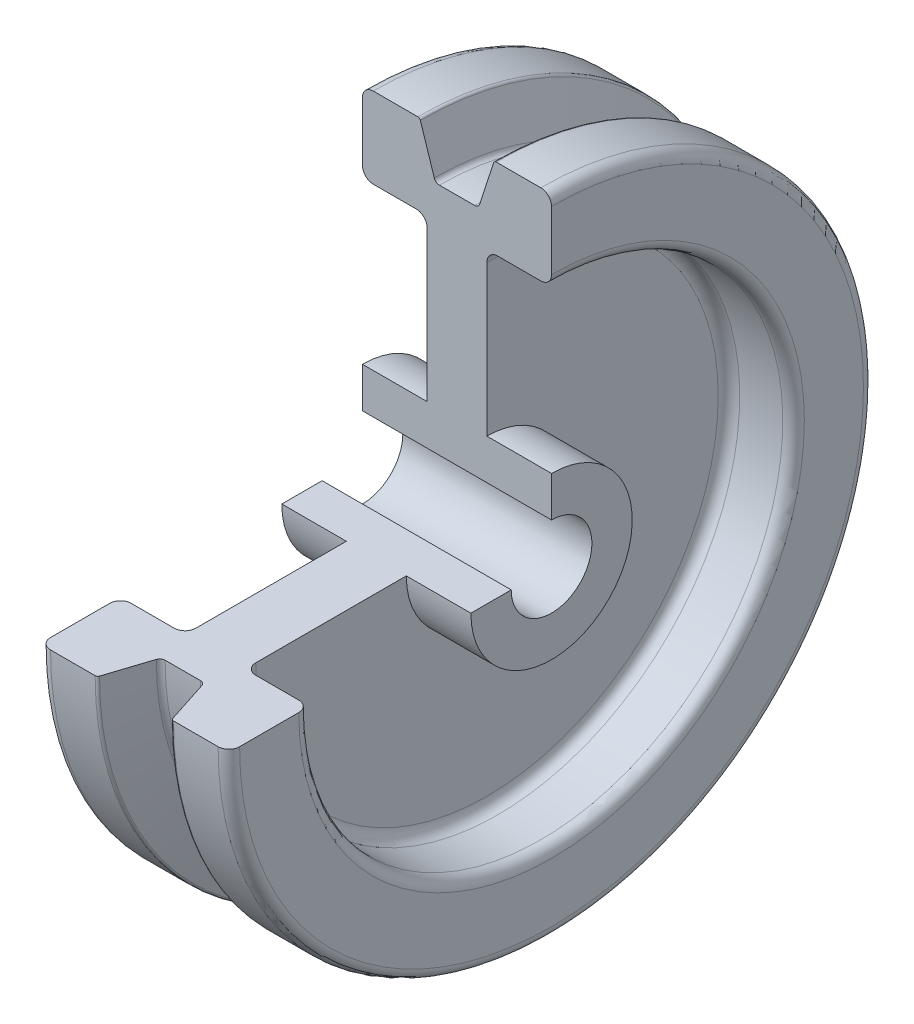
from build123d import *

# Parameters (mm, degrees)
FILLET_1_R          = 0.5
FILLET_2_R          = 1
FILLET_3_R          = 2
SKETCH_2_W          = 70
SKETCH_2_H          = 70
CUT_EXTRUDE_2_DEPTH = 40
FILLET_4_R          = 2


with BuildPart() as part:
    # 스케치1 → 회전1 (revolve)
    with BuildSketch(Plane.XY, mode=Mode.PRIVATE) as revolve_1_sk:
        Polygon((2.856091268, 7.5), (20.435341988, 7.5), (20.435341988, 15), (8.42765707, 15), (8.42765707, 45), (20.435341988, 45), (20.435341988, 60), (9.780368534, 60), (6.856091268, 51), (2.856091268, 51), align=None)
    revolve_1 = revolve(revolve_1_sk.sketch.rotate(Axis((-22.814601345, 0, 0), (1, 0, 0)), 90), axis=Axis((-22.814601345, 0, 0), (1, 0, 0)))

    # 대칭 복사2: 회전1 across plane
    add(revolve_1.mirror(Plane(origin=(2.856091268, 51, 0), x_dir=(0, 0, 1), z_dir=(1, 0, 0))))

    # 필렛1
    fillet_1_edges = [part.edges().sort_by_distance(p)[0] for p in [
        (-4.068185998, 0, -60),
        (9.780368534, 0, -60),
    ]]
    fillet(fillet_1_edges, radius=FILLET_1_R)

    # 필렛2
    fillet_2_edges = [part.edges().sort_by_distance(p)[0] for p in [
        (-1.143908732, 0, -51),
        (6.856091268, 0, -51),
    ]]
    fillet(fillet_2_edges, radius=FILLET_2_R)

    # 필렛3
    fillet_3_edges = [part.edges().sort_by_distance(p)[0] for p in [
        (-14.723159453, 0, -60),
        (20.435341988, 0, -60),
    ]]
    fillet(fillet_3_edges, radius=FILLET_3_R)

    # 스케치2 → 컷-돌출2 (cut)
    with BuildSketch(Plane(origin=(20.435341988, 0, 0), x_dir=(0, 0, -1), z_dir=(1, 0, 0))):
        with Locations((-35, 35)):
            Rectangle(SKETCH_2_W, SKETCH_2_H)
    extrude(amount=-CUT_EXTRUDE_2_DEPTH, mode=Mode.SUBTRACT)

    # 필렛4
    fillet_4_edges = [part.edges().sort_by_distance(p)[0] for p in [
        (-14.723159453, -31.819805153, -31.819805153),
        (-2.715474534, -31.819805153, -31.819805153),
        (20.435341988, -31.819805153, -31.819805153),
        (8.42765707, -31.819805153, -31.819805153),
    ]]
    fillet(fillet_4_edges, radius=FILLET_4_R)


solid = part.part
